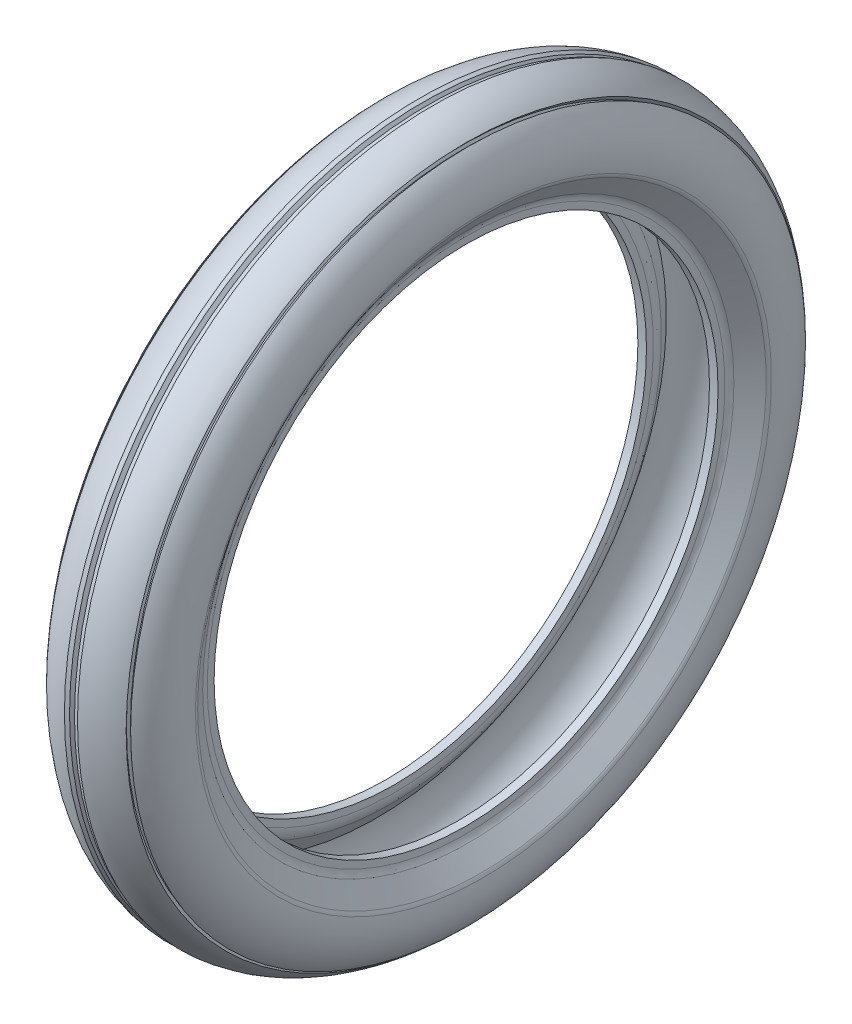
from build123d import *


with BuildPart() as part:
    # Sketch2 → Revolve2 (revolve)
    with BuildSketch(Plane.XY, mode=Mode.PRIVATE) as revolve2_sk:
        with BuildLine():
            Line((-35, 220), (-35, 226))
            ThreePointArc((-35, 226), (-35.492780162, 229.100446896), (-36.922554191, 231.895326047))
            Line((-36.922554191, 231.895326047), (-48.821387112, 248.198440981))
            ThreePointArc((-48.821387112, 248.198440981), (-49.685582806, 249.733408382), (-50.167919798, 251.427607352))
            ThreePointArc((-50.167919798, 251.427607352), (-48.520270823, 274.60100052), (-36.730637372, 294.619128334))
            Line((-36.730637372, 294.619128334), (-32.527914799, 290.601469224))
            Line((-32.527914799, 290.601469224), (-31.336809928, 292.926620842))
            Line((-31.336809928, 292.926620842), (-34.771348339, 296.560344263))
            ThreePointArc((-34.771348339, 296.560344263), (-21.319516696, 305.631344339), (-5.69422743, 310))
            Line((-5.69422743, 310), (-2.676070997, 308.539216039))
            Line((-2.676070997, 308.539216039), (0, 304.470504111))
            Line((0, 304.470504111), (1.666206498, 308.539216039))
            Line((1.666206498, 308.539216039), (5.69422743, 310))
            ThreePointArc((5.69422743, 310), (21.319516696, 305.631344339), (34.771348339, 296.560344263))
            Line((34.771348339, 296.560344263), (31.336809928, 292.926620842))
            Line((31.336809928, 292.926620842), (32.527914799, 290.601469224))
            Line((32.527914799, 290.601469224), (36.730637372, 294.619128334))
            ThreePointArc((36.730637372, 294.619128334), (48.520270823, 274.60100052), (50.167919798, 251.427607352))
            ThreePointArc((50.167919798, 251.427607352), (49.685582806, 249.733408382), (48.821387112, 248.198440981))
            Line((48.821387112, 248.198440981), (36.922554191, 231.895326047))
            ThreePointArc((36.922554191, 231.895326047), (35.492780162, 229.100446896), (35, 226))
            Line((35, 226), (35, 220))
            Line((35, 220), (27.5, 220))
            Line((27.5, 220), (27.5, 226))
            ThreePointArc((27.5, 226), (28.362365284, 231.425782068), (30.864469834, 236.316820582))
            Line((30.864469834, 236.316820582), (42.763302755, 252.619935516))
            ThreePointArc((42.763302755, 252.619935516), (0, 302.820055089), (-42.763302755, 252.619935516))
            Line((-42.763302755, 252.619935516), (-30.864469834, 236.316820582))
            ThreePointArc((-30.864469834, 236.316820582), (-28.362365284, 231.425782068), (-27.5, 226))
            Line((-27.5, 226), (-27.5, 220))
            Line((-27.5, 220), (-35, 220))
        make_face()
    revolve(revolve2_sk.sketch.rotate(Axis((-71.60839807, 0, 0), (1, 0, 0)), 90), axis=Axis((-71.60839807, 0, 0), (1, 0, 0)))


solid = part.part
